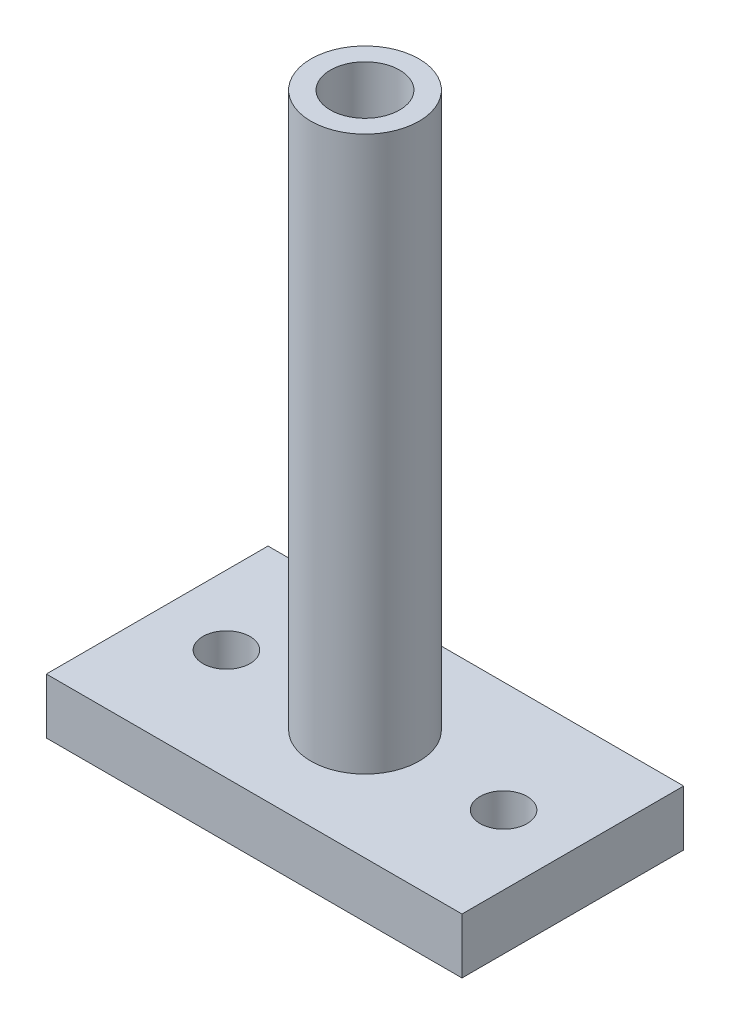
from build123d import *

# Parameters (mm, degrees)
SKETCH_1_W          = 15
SKETCH_1_H          = 8
SKETCH_1_R          = 0.85
EXTRUDE_1_DEPTH     = 2
SKETCH_2_R          = 1.95
EXTRUDE_2_DEPTH     = 20
SKETCH_3_R          = 1.25
CUT_EXTRUDE_1_DEPTH = 5


with BuildPart() as part:
    # 草图1 → 凸台-拉伸1 (new body)
    with BuildSketch(Plane(origin=(0, 0, 0), x_dir=(1, 0, 0), z_dir=(0, 1, 0))):
        with Locations((7.5, 4)):
            Rectangle(SKETCH_1_W, SKETCH_1_H)
        with Locations(Location((2.5, 4, 0), (0, 0, 270))):
            Circle(SKETCH_1_R, mode=Mode.SUBTRACT)
        with Locations(Location((12.5, 4, 0), (0, 0, 90))):
            Circle(SKETCH_1_R, mode=Mode.SUBTRACT)
    extrude(amount=EXTRUDE_1_DEPTH)

    # 草图2 → 凸台-拉伸2 (add)
    with BuildSketch(Plane(origin=(0, 2, 0), x_dir=(1, 0, 0), z_dir=(0, 1, 0))):
        with Locations(Location((7.5, 4, 0), (0, 0, 90))):
            Circle(SKETCH_2_R)
    extrude(amount=EXTRUDE_2_DEPTH)

    # 草图3 → 切除-拉伸1 (cut)
    with BuildSketch(Plane(origin=(0, 22, 0), x_dir=(1, 0, 0), z_dir=(0, 1, 0))):
        with Locations(Location((7.5, 4, 0), (0, 0, 270))):
            Circle(SKETCH_3_R)
    extrude(amount=-CUT_EXTRUDE_1_DEPTH, mode=Mode.SUBTRACT)


solid = part.part
